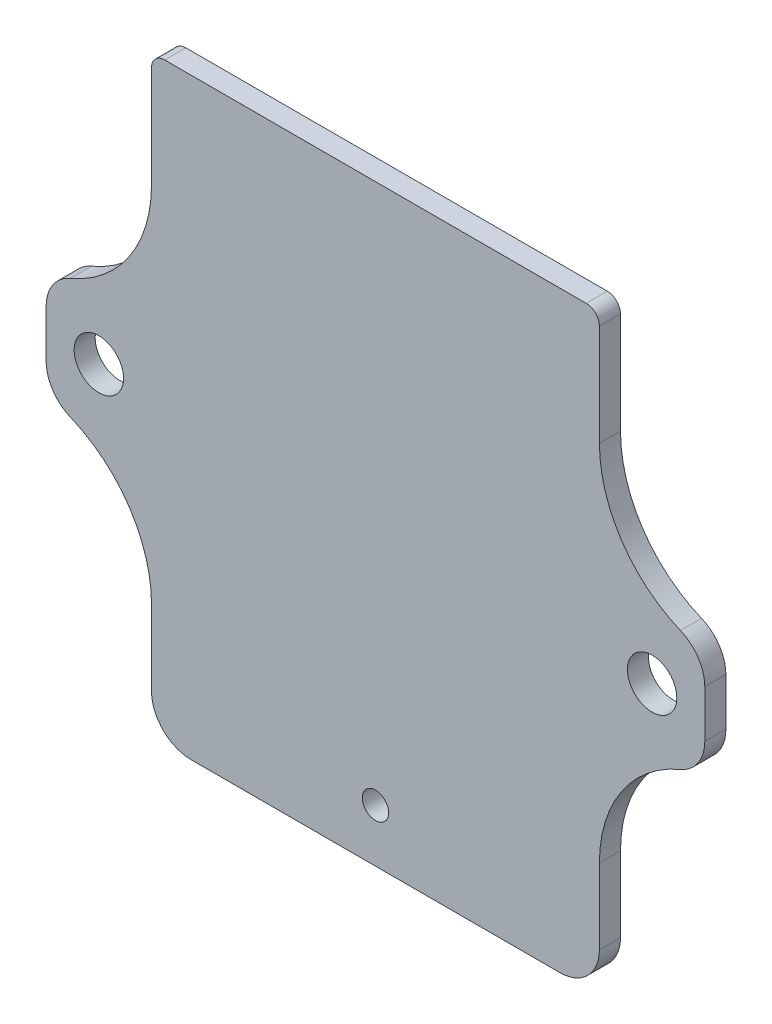
from build123d import *

# Parameters (mm, degrees)
SKETCH1_R           = 1
SKETCH1_R_2         = 1.875
BOSS_EXTRUDE1_DEPTH = 1.6


with BuildPart() as part:
    # Sketch1 → Boss-Extrude1 (new body)
    with BuildSketch(Plane.XY):
        with BuildLine():
            Line((30.883756862, 108.134882568), (30.883756862, 115.836923597))
            ThreePointArc((30.883756862, 115.836923597), (30.590863643, 116.544030379), (29.883756862, 116.836923597))
            Line((29.883756862, 116.836923597), (-2.116243138, 116.836923597))
            ThreePointArc((-2.116243138, 116.836923597), (-2.82334992, 116.544030379), (-3.116243138, 115.836923597))
            Line((-3.116243138, 115.836923597), (-3.116243138, 108.134882568))
            ThreePointArc((-3.116243138, 108.134882568), (-4.795740195, 102.587880606), (-9.270089292, 98.904113338))
            ThreePointArc((-9.270089292, 98.904113338), (-10.612394021, 97.798983157), (-11.116243138, 96.134882568))
            Line((-11.116243138, 96.134882568), (-11.116243138, 92.538964626))
            ThreePointArc((-11.116243138, 92.538964626), (-10.612394021, 90.874864038), (-9.270089292, 89.769733857))
            ThreePointArc((-9.270089292, 89.769733857), (-4.795740195, 86.085966588), (-3.116243138, 80.538964626))
            Line((-3.116243138, 80.538964626), (-3.116243138, 74.836923597))
            ThreePointArc((-3.116243138, 74.836923597), (-2.237563482, 72.715603254), (-0.116243138, 71.836923597))
            Line((-0.116243138, 71.836923597), (27.883756862, 71.836923597))
            ThreePointArc((27.883756862, 71.836923597), (30.005077205, 72.715603254), (30.883756862, 74.836923597))
            Line((30.883756862, 74.836923597), (30.883756862, 80.538964626))
            ThreePointArc((30.883756862, 80.538964626), (32.563253918, 86.085966588), (37.037603016, 89.769733857))
            ThreePointArc((37.037603016, 89.769733857), (38.379907745, 90.874864038), (38.883756862, 92.538964626))
            Line((38.883756862, 92.538964626), (38.883756862, 96.134882568))
            ThreePointArc((38.883756862, 96.134882568), (38.379907745, 97.798983157), (37.037603016, 98.904113338))
            ThreePointArc((37.037603016, 98.904113338), (32.563253918, 102.587880606), (30.883756862, 108.134882568))
        make_face()
        with Locations((13.883756862, 75.836923597)):
            Circle(SKETCH1_R, mode=Mode.SUBTRACT)
        with Locations((-7.116243138, 94.336923597)):
            Circle(SKETCH1_R_2, mode=Mode.SUBTRACT)
        with Locations((34.883756862, 94.336923597)):
            Circle(SKETCH1_R_2, mode=Mode.SUBTRACT)
    extrude(amount=BOSS_EXTRUDE1_DEPTH)


solid = part.part
